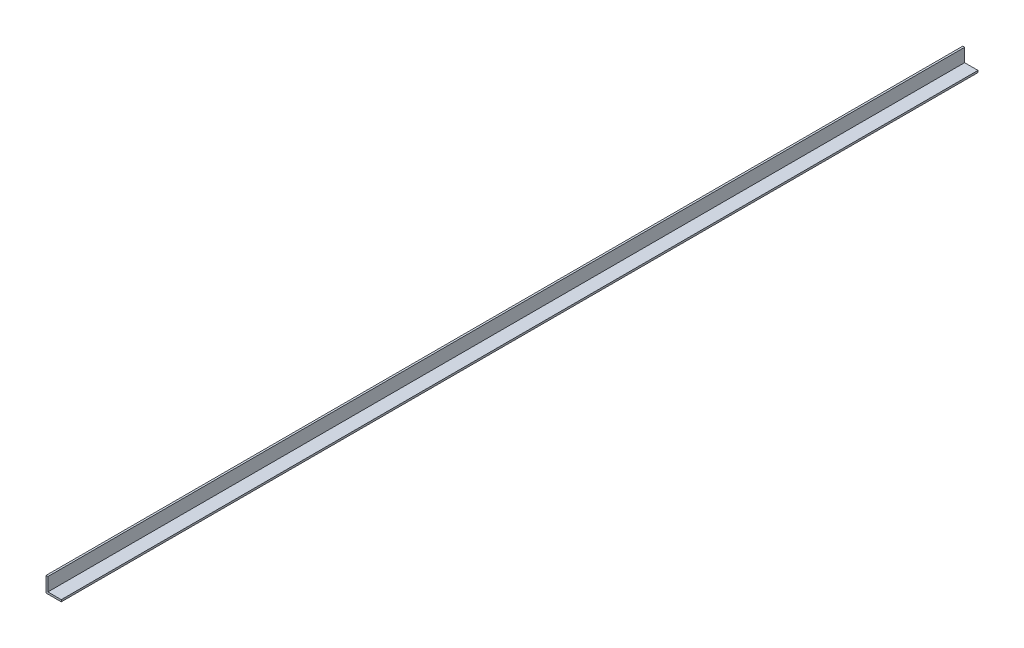
from build123d import *

# Parameters (mm, degrees)
SALIENTE_EXTRUIR1_DEPTH = 6100


with BuildPart() as part:
    # Croquis1 → Saliente-Extruir1 (new body)
    with BuildSketch(Plane.XY):
        Polygon((0, 101.6), (0, 0), (101.6, 0), (101.6, 12.7), (12.7, 12.7), (12.7, 101.6), align=None)
    extrude(amount=-SALIENTE_EXTRUIR1_DEPTH)


solid = part.part
